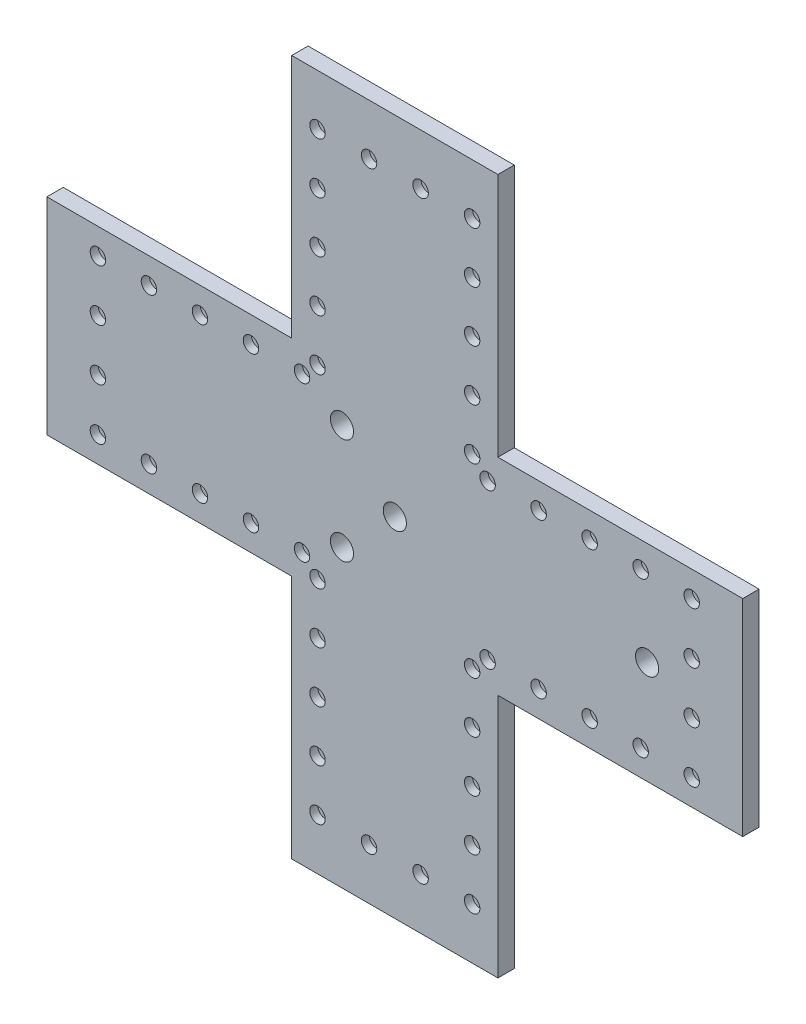
from build123d import *

# Parameters (mm, degrees)
SKETCH1_R           = 1.5
SKETCH1_R_2         = 2.2479
BOSS_EXTRUDE1_DEPTH = 3.175
SKETCH1_6_R         = 1.5
BOSS_EXTRUDE2_DEPTH = 1.5875


with BuildPart() as part:
    # Sketch1 → Boss-Extrude1 (new body)
    with BuildSketch(Plane.XY):
        Polygon((20, 20), (20, 67.5), (-20, 67.5), (-20, 20), (-67.5, 20), (-67.5, -20), (-20, -20), (-20, -67.5), (20, -67.5), (20, -20), (67.5, -20), (67.5, 20), align=None)
        with Locations((-15, 27.9)):
            Circle(SKETCH1_R, mode=Mode.SUBTRACT)
        with Locations((-15, 37.8)):
            Circle(SKETCH1_R, mode=Mode.SUBTRACT)
        with Locations((-15, 47.7)):
            Circle(SKETCH1_R, mode=Mode.SUBTRACT)
        with Locations((-15, 57.6)):
            Circle(SKETCH1_R, mode=Mode.SUBTRACT)
        with Locations((-5, 57.6)):
            Circle(SKETCH1_R, mode=Mode.SUBTRACT)
        with Locations((15, 27.9)):
            Circle(SKETCH1_R, mode=Mode.SUBTRACT)
        with Locations((15, 37.8)):
            Circle(SKETCH1_R, mode=Mode.SUBTRACT)
        with Locations((15, 47.7)):
            Circle(SKETCH1_R, mode=Mode.SUBTRACT)
        with Locations((5, 57.6)):
            Circle(SKETCH1_R, mode=Mode.SUBTRACT)
        with Locations((15, 57.6)):
            Circle(SKETCH1_R, mode=Mode.SUBTRACT)
        with Locations((15, 18)):
            Circle(SKETCH1_R, mode=Mode.SUBTRACT)
        with Locations((-15, -18)):
            Circle(SKETCH1_R, mode=Mode.SUBTRACT)
        with Locations((-18, -15)):
            Circle(SKETCH1_R, mode=Mode.SUBTRACT)
        with Locations((-10.253048327, -10.253048327)):
            Circle(SKETCH1_R_2, mode=Mode.SUBTRACT)
        with Locations((15, -18)):
            Circle(SKETCH1_R, mode=Mode.SUBTRACT)
        with Locations((18, -15)):
            Circle(SKETCH1_R, mode=Mode.SUBTRACT)
        with Locations((-18, 15)):
            Circle(SKETCH1_R, mode=Mode.SUBTRACT)
        with Locations((-10.253048327, 10.253048327)):
            Circle(SKETCH1_R_2, mode=Mode.SUBTRACT)
        with Locations((-15, 18)):
            Circle(SKETCH1_R, mode=Mode.SUBTRACT)
        Circle(SKETCH1_R_2, mode=Mode.SUBTRACT)
        with Locations((18, 15)):
            Circle(SKETCH1_R, mode=Mode.SUBTRACT)
        with Locations((57.6, 15)):
            Circle(SKETCH1_R, mode=Mode.SUBTRACT)
        with Locations((27.9, -15)):
            Circle(SKETCH1_R, mode=Mode.SUBTRACT)
        with Locations((37.8, -15)):
            Circle(SKETCH1_R, mode=Mode.SUBTRACT)
        with Locations((47.7, -15)):
            Circle(SKETCH1_R, mode=Mode.SUBTRACT)
        with Locations((57.6, -15)):
            Circle(SKETCH1_R, mode=Mode.SUBTRACT)
        with Locations((57.6, -5)):
            Circle(SKETCH1_R, mode=Mode.SUBTRACT)
        with Locations((27.9, 15)):
            Circle(SKETCH1_R, mode=Mode.SUBTRACT)
        with Locations((48.94, 0)):
            Circle(SKETCH1_R_2, mode=Mode.SUBTRACT)
        with Locations((37.8, 15)):
            Circle(SKETCH1_R, mode=Mode.SUBTRACT)
        with Locations((47.7, 15)):
            Circle(SKETCH1_R, mode=Mode.SUBTRACT)
        with Locations((57.6, 5)):
            Circle(SKETCH1_R, mode=Mode.SUBTRACT)
        with Locations((15, -27.9)):
            Circle(SKETCH1_R, mode=Mode.SUBTRACT)
        with Locations((-15, -57.6)):
            Circle(SKETCH1_R, mode=Mode.SUBTRACT)
        with Locations((-5, -57.6)):
            Circle(SKETCH1_R, mode=Mode.SUBTRACT)
        with Locations((-15, -47.7)):
            Circle(SKETCH1_R, mode=Mode.SUBTRACT)
        with Locations((-15, -37.8)):
            Circle(SKETCH1_R, mode=Mode.SUBTRACT)
        with Locations((-15, -27.9)):
            Circle(SKETCH1_R, mode=Mode.SUBTRACT)
        with Locations((5, -57.6)):
            Circle(SKETCH1_R, mode=Mode.SUBTRACT)
        with Locations((15, -57.6)):
            Circle(SKETCH1_R, mode=Mode.SUBTRACT)
        with Locations((15, -47.7)):
            Circle(SKETCH1_R, mode=Mode.SUBTRACT)
        with Locations((15, -37.8)):
            Circle(SKETCH1_R, mode=Mode.SUBTRACT)
        with Locations((-27.9, 15)):
            Circle(SKETCH1_R, mode=Mode.SUBTRACT)
        with Locations((-57.6, -15)):
            Circle(SKETCH1_R, mode=Mode.SUBTRACT)
        with Locations((-57.6, -5)):
            Circle(SKETCH1_R, mode=Mode.SUBTRACT)
        with Locations((-47.7, -15)):
            Circle(SKETCH1_R, mode=Mode.SUBTRACT)
        with Locations((-37.8, -15)):
            Circle(SKETCH1_R, mode=Mode.SUBTRACT)
        with Locations((-27.9, -15)):
            Circle(SKETCH1_R, mode=Mode.SUBTRACT)
        with Locations((-57.6, 5)):
            Circle(SKETCH1_R, mode=Mode.SUBTRACT)
        with Locations((-57.6, 15)):
            Circle(SKETCH1_R, mode=Mode.SUBTRACT)
        with Locations((-47.7, 15)):
            Circle(SKETCH1_R, mode=Mode.SUBTRACT)
        with Locations((-37.8, 15)):
            Circle(SKETCH1_R, mode=Mode.SUBTRACT)
    extrude(amount=BOSS_EXTRUDE1_DEPTH)

    # Sketch1<6> → Boss-Extrude2 (add)
    with BuildSketch(Plane.XY):
        with Locations((27.9, 15)):
            Circle(SKETCH1_6_R)
        with Locations((37.8, 15)):
            Circle(SKETCH1_6_R)
        with Locations((47.7, 15)):
            Circle(SKETCH1_6_R)
        with Locations((57.6, 15)):
            Circle(SKETCH1_6_R)
        with Locations((18, 15)):
            Circle(SKETCH1_6_R)
        with Locations((57.6, 5)):
            Circle(SKETCH1_6_R)
        with Locations((27.9, -15)):
            Circle(SKETCH1_6_R)
        with Locations((37.8, -15)):
            Circle(SKETCH1_6_R)
        with Locations((47.7, -15)):
            Circle(SKETCH1_6_R)
        with Locations((57.6, -5)):
            Circle(SKETCH1_6_R)
        with Locations((57.6, -15)):
            Circle(SKETCH1_6_R)
        with Locations((18, -15)):
            Circle(SKETCH1_6_R)
        with Locations((-18, -15)):
            Circle(SKETCH1_6_R)
        with Locations((-27.9, -15)):
            Circle(SKETCH1_6_R)
        with Locations((-37.8, -15)):
            Circle(SKETCH1_6_R)
        with Locations((-47.7, -15)):
            Circle(SKETCH1_6_R)
        with Locations((-57.6, -15)):
            Circle(SKETCH1_6_R)
        with Locations((-57.6, -5)):
            Circle(SKETCH1_6_R)
        with Locations((-57.6, 5)):
            Circle(SKETCH1_6_R)
        with Locations((-37.8, 15)):
            Circle(SKETCH1_6_R)
        with Locations((-47.7, 15)):
            Circle(SKETCH1_6_R)
        with Locations((-57.6, 15)):
            Circle(SKETCH1_6_R)
        with Locations((-27.9, 15)):
            Circle(SKETCH1_6_R)
        with Locations((-18, 15)):
            Circle(SKETCH1_6_R)
        with Locations((-15, 57.6)):
            Circle(SKETCH1_6_R)
        with Locations((-5, 57.6)):
            Circle(SKETCH1_6_R)
        with Locations((-15, 47.7)):
            Circle(SKETCH1_6_R)
        with Locations((-15, 37.8)):
            Circle(SKETCH1_6_R)
        with Locations((-15, 27.9)):
            Circle(SKETCH1_6_R)
        with Locations((-15, 18)):
            Circle(SKETCH1_6_R)
        with Locations((15, 18)):
            Circle(SKETCH1_6_R)
        with Locations((15, 27.9)):
            Circle(SKETCH1_6_R)
        with Locations((15, 37.8)):
            Circle(SKETCH1_6_R)
        with Locations((15, 47.7)):
            Circle(SKETCH1_6_R)
        with Locations((15, 57.6)):
            Circle(SKETCH1_6_R)
        with Locations((5, 57.6)):
            Circle(SKETCH1_6_R)
        with Locations((-15, -18)):
            Circle(SKETCH1_6_R)
        with Locations((-15, -27.9)):
            Circle(SKETCH1_6_R)
        with Locations((-15, -37.8)):
            Circle(SKETCH1_6_R)
        with Locations((-15, -47.7)):
            Circle(SKETCH1_6_R)
        with Locations((-15, -57.6)):
            Circle(SKETCH1_6_R)
        with Locations((-5, -57.6)):
            Circle(SKETCH1_6_R)
        with Locations((5, -57.6)):
            Circle(SKETCH1_6_R)
        with Locations((15, -57.6)):
            Circle(SKETCH1_6_R)
        with Locations((15, -47.7)):
            Circle(SKETCH1_6_R)
        with Locations((15, -37.8)):
            Circle(SKETCH1_6_R)
        with Locations((15, -27.9)):
            Circle(SKETCH1_6_R)
        with Locations((15, -18)):
            Circle(SKETCH1_6_R)
    extrude(amount=BOSS_EXTRUDE2_DEPTH)


solid = part.part
